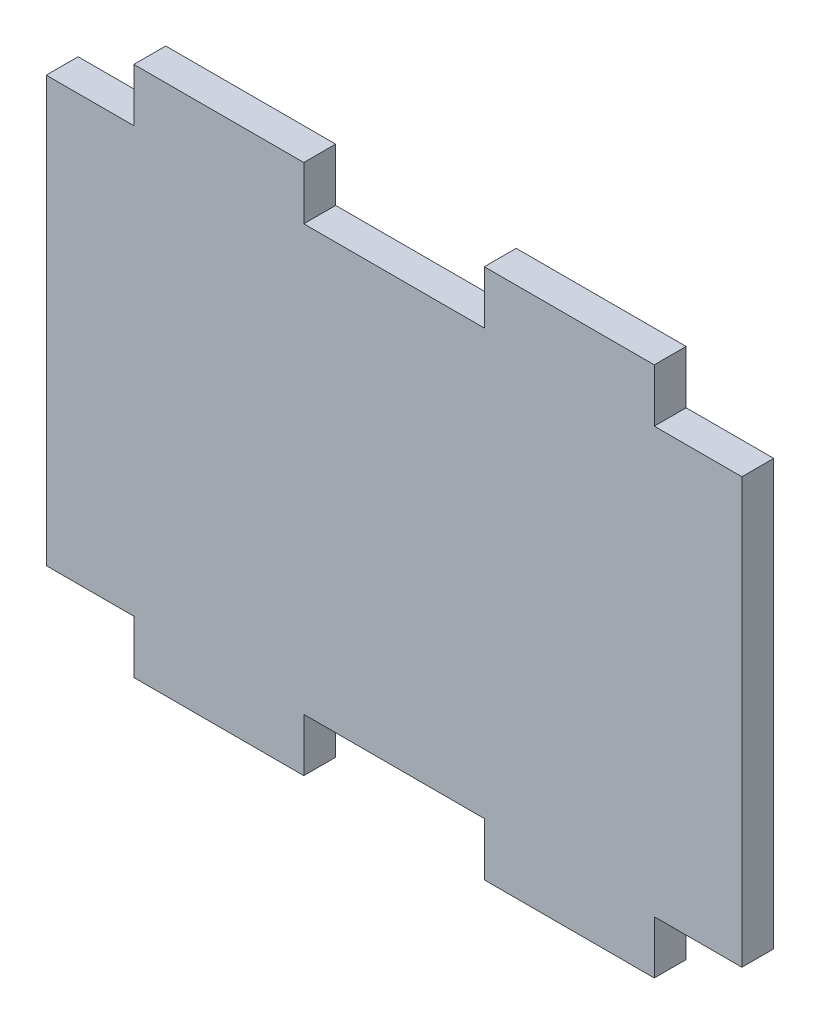
from build123d import *

# Parameters (mm, degrees)
BOSS_EXTRU_1_DEPTH = 6


with BuildPart() as part:
    # Esquisse1 → Boss.-Extru.1 (new body)
    with BuildSketch(Plane.XY):
        Polygon((49, -4), (49, 6), (65.5, 6), (65.5, 86), (49, 86), (49, 96), (17, 96), (17, 86), (-17, 86), (-17, 96), (-49, 96), (-49, 86), (-65.5, 86), (-65.5, 6), (-49, 6), (-49, -4), (-17, -4), (-17, 6), (17, 6), (17, -4), align=None)
    extrude(amount=BOSS_EXTRU_1_DEPTH)


solid = part.part
